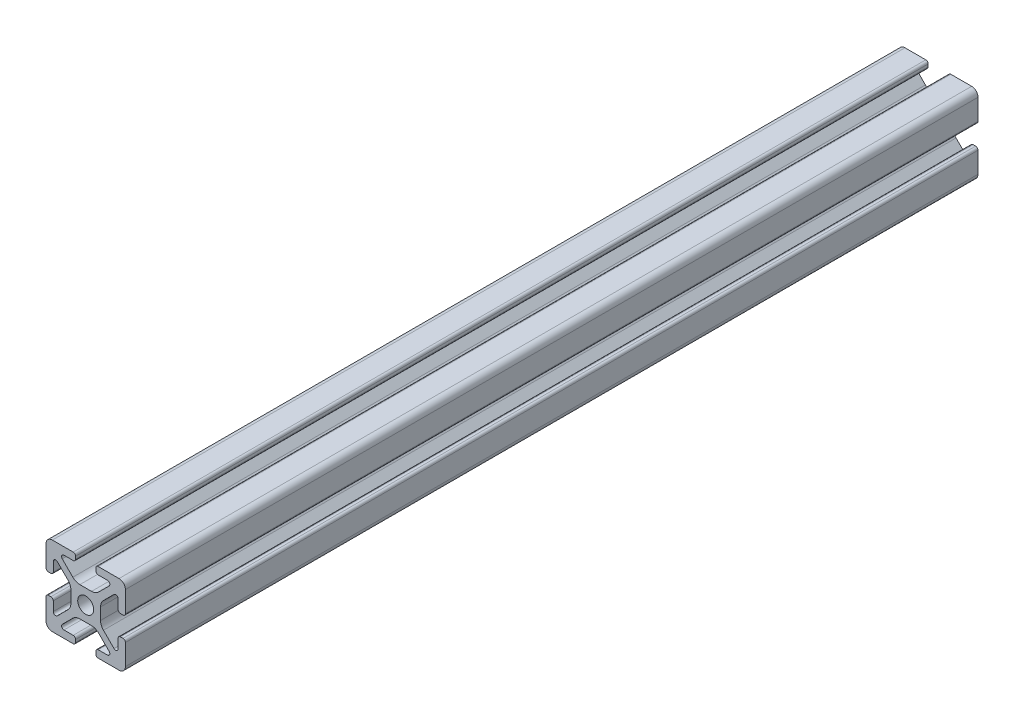
from build123d import *

# Parameters (mm, degrees)
SKETCH1_R           = 2.5527
BOSS_EXTRUDE1_DEPTH = 272.796


with BuildPart() as part:
    # Sketch1 → Boss-Extrude1 (new body)
    with BuildSketch(Plane.XY):
        with BuildLine():
            Line((-7.499820068, 9.062384633), (-4.117171405, 5.67973597))
            ThreePointArc((-4.117171405, 5.67973597), (-3.087127272, 4.991482484), (-1.872107374, 4.7498))
            Line((-1.872107374, 4.7498), (1.872107374, 4.7498))
            ThreePointArc((1.872107374, 4.7498), (3.087127272, 4.991482484), (4.117171405, 5.67973597))
            Line((4.117171405, 5.67973597), (7.499820068, 9.062384633))
            ThreePointArc((7.499820068, 9.062384633), (7.665000904, 9.892804775), (6.9610047, 10.3632))
            Line((6.9610047, 10.3632), (4.0005, 10.3632))
            ThreePointArc((4.0005, 10.3632), (3.461684633, 10.586384633), (3.2385, 11.1252))
            Line((3.2385, 11.1252), (3.2385, 11.938))
            ThreePointArc((3.2385, 11.938), (3.461684633, 12.476815367), (4.0005, 12.7))
            Line((4.0005, 12.7), (10.668, 12.7))
            ThreePointArc((10.668, 12.7), (12.104840979, 12.104840979), (12.7, 10.668))
            Line((12.7, 10.668), (12.7, 4.0005))
            ThreePointArc((12.7, 4.0005), (12.476815367, 3.461684633), (11.938, 3.2385))
            Line((11.938, 3.2385), (11.1252, 3.2385))
            ThreePointArc((11.1252, 3.2385), (10.586384633, 3.461684633), (10.3632, 4.0005))
            Line((10.3632, 4.0005), (10.3632, 6.9610047))
            ThreePointArc((10.3632, 6.9610047), (9.892804775, 7.665000904), (9.062384633, 7.499820068))
            Line((9.062384633, 7.499820068), (5.67973597, 4.117171405))
            ThreePointArc((5.67973597, 4.117171405), (4.991482484, 3.087127272), (4.7498, 1.872107374))
            Line((4.7498, 1.872107374), (4.7498, -1.872107374))
            ThreePointArc((4.7498, -1.872107374), (4.991482484, -3.087127272), (5.67973597, -4.117171405))
            Line((5.67973597, -4.117171405), (9.062384633, -7.499820068))
            ThreePointArc((9.062384633, -7.499820068), (9.892804775, -7.665000904), (10.3632, -6.9610047))
            Line((10.3632, -6.9610047), (10.3632, -4.0005))
            ThreePointArc((10.3632, -4.0005), (10.586384633, -3.461684633), (11.1252, -3.2385))
            Line((11.1252, -3.2385), (11.938, -3.2385))
            ThreePointArc((11.938, -3.2385), (12.476815367, -3.461684633), (12.7, -4.0005))
            Line((12.7, -4.0005), (12.7, -10.668))
            ThreePointArc((12.7, -10.668), (12.104840979, -12.104840979), (10.668, -12.7))
            Line((10.668, -12.7), (4.0005, -12.7))
            ThreePointArc((4.0005, -12.7), (3.461684633, -12.476815367), (3.2385, -11.938))
            Line((3.2385, -11.938), (3.2385, -11.1252))
            ThreePointArc((3.2385, -11.1252), (3.461684633, -10.586384633), (4.0005, -10.3632))
            Line((4.0005, -10.3632), (6.9610047, -10.3632))
            ThreePointArc((6.9610047, -10.3632), (7.665000904, -9.892804775), (7.499820068, -9.062384633))
            Line((7.499820068, -9.062384633), (4.117171405, -5.67973597))
            ThreePointArc((4.117171405, -5.67973597), (3.087127272, -4.991482484), (1.872107374, -4.7498))
            Line((1.872107374, -4.7498), (-1.872107374, -4.7498))
            ThreePointArc((-1.872107374, -4.7498), (-3.087127272, -4.991482484), (-4.117171405, -5.67973597))
            Line((-4.117171405, -5.67973597), (-7.499820068, -9.062384633))
            ThreePointArc((-7.499820068, -9.062384633), (-7.665000904, -9.892804775), (-6.9610047, -10.3632))
            Line((-6.9610047, -10.3632), (-4.0005, -10.3632))
            ThreePointArc((-4.0005, -10.3632), (-3.461684633, -10.586384633), (-3.2385, -11.1252))
            Line((-3.2385, -11.1252), (-3.2385, -11.938))
            ThreePointArc((-3.2385, -11.938), (-3.461684633, -12.476815367), (-4.0005, -12.7))
            Line((-4.0005, -12.7), (-10.668, -12.7))
            ThreePointArc((-10.668, -12.7), (-12.104840979, -12.104840979), (-12.7, -10.668))
            Line((-12.7, -10.668), (-12.7, -4.0005))
            ThreePointArc((-12.7, -4.0005), (-12.476815367, -3.461684633), (-11.938, -3.2385))
            Line((-11.938, -3.2385), (-11.1252, -3.2385))
            ThreePointArc((-11.1252, -3.2385), (-10.586384633, -3.461684633), (-10.3632, -4.0005))
            Line((-10.3632, -4.0005), (-10.3632, -6.9610047))
            ThreePointArc((-10.3632, -6.9610047), (-9.892804775, -7.665000904), (-9.062384633, -7.499820068))
            Line((-9.062384633, -7.499820068), (-5.67973597, -4.117171405))
            ThreePointArc((-5.67973597, -4.117171405), (-4.991482484, -3.087127272), (-4.7498, -1.872107374))
            Line((-4.7498, -1.872107374), (-4.7498, 1.872107374))
            ThreePointArc((-4.7498, 1.872107374), (-4.991482484, 3.087127272), (-5.67973597, 4.117171405))
            Line((-5.67973597, 4.117171405), (-9.062384633, 7.499820068))
            ThreePointArc((-9.062384633, 7.499820068), (-9.892804775, 7.665000904), (-10.3632, 6.9610047))
            Line((-10.3632, 6.9610047), (-10.3632, 4.0005))
            ThreePointArc((-10.3632, 4.0005), (-10.586384633, 3.461684633), (-11.1252, 3.2385))
            Line((-11.1252, 3.2385), (-11.938, 3.2385))
            ThreePointArc((-11.938, 3.2385), (-12.476815367, 3.461684633), (-12.7, 4.0005))
            Line((-12.7, 4.0005), (-12.7, 10.668))
            ThreePointArc((-12.7, 10.668), (-12.104840979, 12.104840979), (-10.668, 12.7))
            Line((-10.668, 12.7), (-4.0005, 12.7))
            ThreePointArc((-4.0005, 12.7), (-3.461684633, 12.476815367), (-3.2385, 11.938))
            Line((-3.2385, 11.938), (-3.2385, 11.1252))
            ThreePointArc((-3.2385, 11.1252), (-3.461684633, 10.586384633), (-4.0005, 10.3632))
            Line((-4.0005, 10.3632), (-6.9610047, 10.3632))
            ThreePointArc((-6.9610047, 10.3632), (-7.665000904, 9.892804775), (-7.499820068, 9.062384633))
        make_face()
        Circle(SKETCH1_R, mode=Mode.SUBTRACT)
    extrude(amount=BOSS_EXTRUDE1_DEPTH)


solid = part.part
